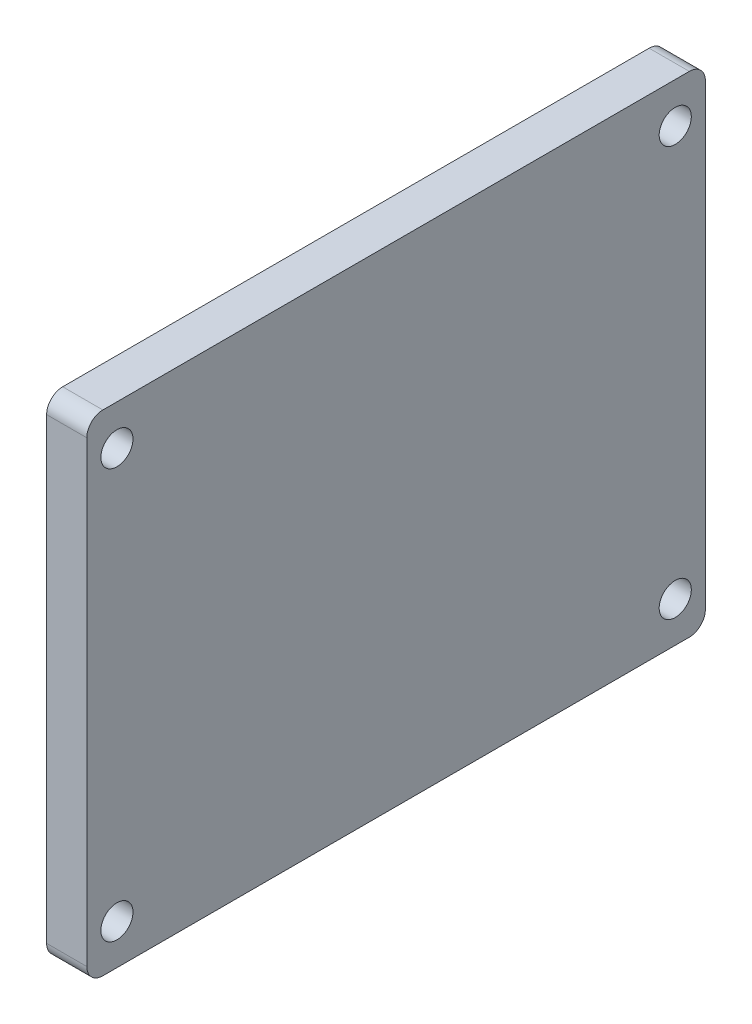
from build123d import *

# Parameters (mm, degrees)
CROQUIS1_W              = 77
CROQUIS1_H              = 61
SALIENTE_EXTRUIR1_DEPTH = 5
CROQUIS2_R              = 2
CORTAR_EXTRUIR1_DEPTH   = 5
REDONDEO2_R             = 2
REDONDEO3_R             = 2
REDONDEO4_R             = 2


with BuildPart() as part:
    # Croquis1 → Saliente-Extruir1 (new body)
    with BuildSketch(Plane(origin=(0, 0, 0), x_dir=(0, 0, -1), z_dir=(1, 0, 0))):
        Rectangle(CROQUIS1_W, CROQUIS1_H)
    extrude(amount=SALIENTE_EXTRUIR1_DEPTH)

    # Croquis2 → Cortar-Extruir1 (cut)
    with BuildSketch(Plane(origin=(5, 0, 0), x_dir=(0, 0, -1), z_dir=(1, 0, 0))):
        with Locations((-34.75, 25.5)):
            Circle(CROQUIS2_R)
        with Locations((-34.75, -25.5)):
            Circle(CROQUIS2_R)
        with Locations((34.75, 25.5)):
            Circle(CROQUIS2_R)
        with Locations((34.75, -25.5)):
            Circle(CROQUIS2_R)
    extrude(amount=-CORTAR_EXTRUIR1_DEPTH, mode=Mode.SUBTRACT)

    # Redondeo2
    redondeo2_edges = [part.edges().sort_by_distance(p)[0] for p in [
        (2.5, 30.5, 38.5),
    ]]
    fillet(redondeo2_edges, radius=REDONDEO2_R)

    # Redondeo3
    redondeo3_edges = [part.edges().sort_by_distance(p)[0] for p in [
        (2.5, 30.5, -38.5),
    ]]
    fillet(redondeo3_edges, radius=REDONDEO3_R)

    # Redondeo4
    redondeo4_edges = [part.edges().sort_by_distance(p)[0] for p in [
        (2.5, -30.5, -38.5),
        (2.5, -30.5, 38.5),
    ]]
    fillet(redondeo4_edges, radius=REDONDEO4_R)


solid = part.part
